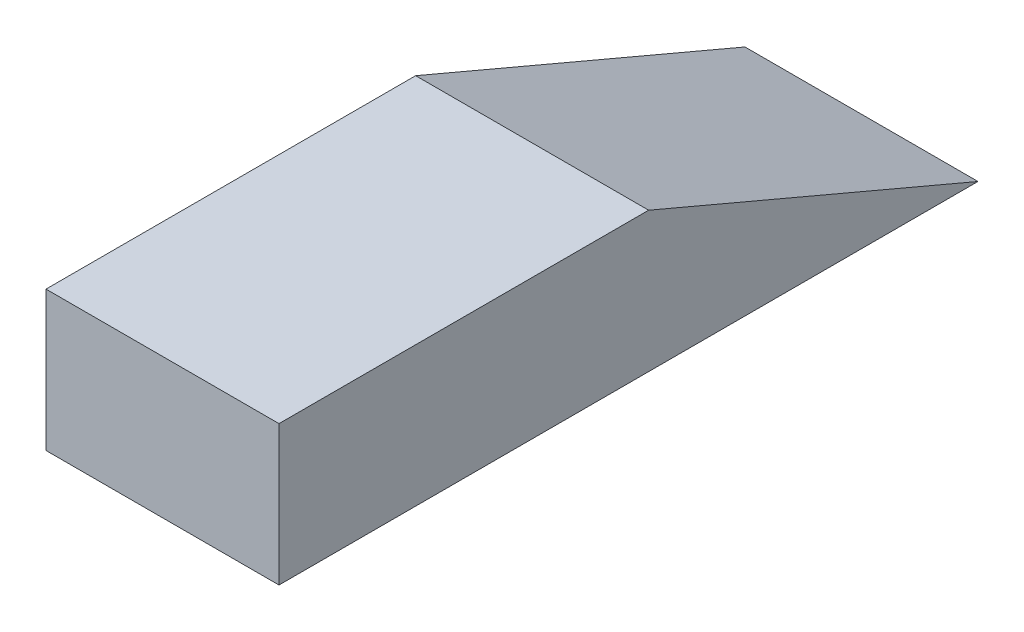
from build123d import *

# Parameters (mm, degrees)
SKETCH1_W           = 50
SKETCH1_H           = 30
BOSS_EXTRUDE1_DEPTH = 150
CUT_EXTRUDE1_DEPTH  = 159.823801743


with BuildPart() as part:
    # Sketch1 → Boss-Extrude1 (new body)
    with BuildSketch(Plane.XY):
        Rectangle(SKETCH1_W, SKETCH1_H)
    extrude(amount=BOSS_EXTRUDE1_DEPTH)

    # Sketch2 → Cut-Extrude1 (cut, through all)
    with BuildSketch(Plane(origin=(25, 0, 0), x_dir=(0, 0, -1), z_dir=(1, 0, 0))):
        Polygon((0, -15), (-70.675570975, 15), (0, 15), align=None)
    extrude(amount=-CUT_EXTRUDE1_DEPTH, mode=Mode.SUBTRACT)


solid = part.part
